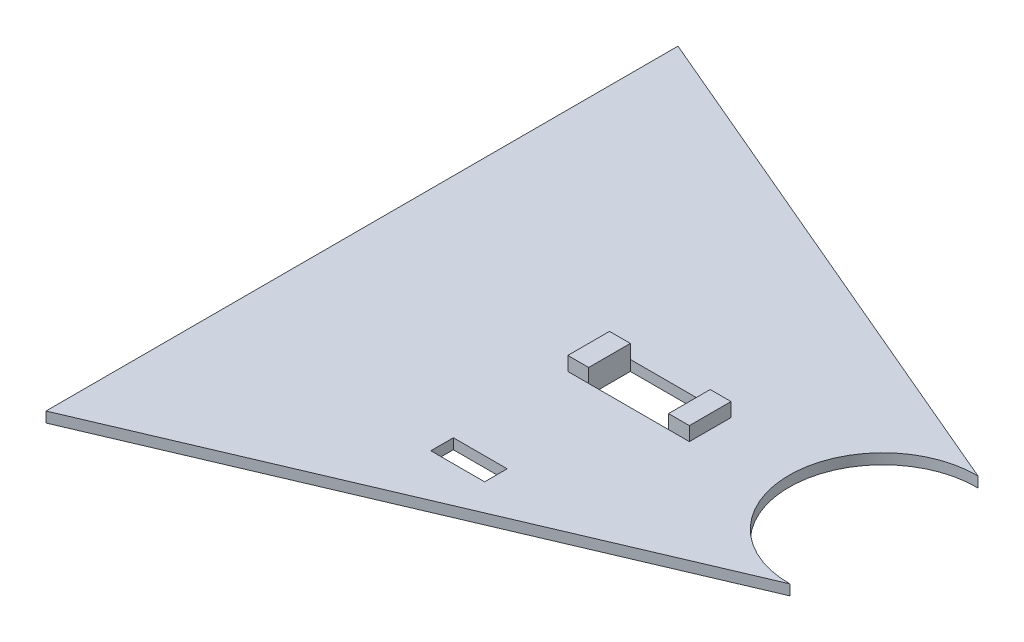
from build123d import *

# Parameters (mm, degrees)
BOSS_EXTRUDE1_DEPTH = 3
SKETCH2_W           = 15.500819923
SKETCH2_H           = 6.5
CUT_EXTRUDE1_DEPTH  = 176.817329233
SKETCH3_W           = 23
SKETCH3_H           = 12
CUT_EXTRUDE2_DEPTH  = 176.817329233
SKETCH4_W           = 6
SKETCH4_H           = 12
BOSS_EXTRUDE2_DEPTH = 4


with BuildPart() as part:
    # Sketch1 → Boss-Extrude1 (new body)
    with BuildSketch(Plane(origin=(0, 0, 0), x_dir=(1, 0, 0), z_dir=(0, 1, 0))):
        with BuildLine():
            Line((0, -91), (0, 91))
            Line((0, 91), (150.405230157, 26.996958875))
            ThreePointArc((150.405230157, 26.996958875), (123.000159405, 0.092778483), (150.219685616, -26.999106249))
            Line((150.219685616, -26.999106249), (0, -91))
        make_face()
    extrude(amount=BOSS_EXTRUDE1_DEPTH)

    # Sketch2 → Cut-Extrude1 (cut, through all)
    with BuildSketch(Plane(origin=(0, 3, 0), x_dir=(1, 0, 0), z_dir=(0, 1, 0))):
        with Locations((73.073381573, -42.257557828)):
            Rectangle(SKETCH2_W, SKETCH2_H)
    extrude(amount=-CUT_EXTRUDE1_DEPTH, mode=Mode.SUBTRACT)

    # Sketch3 → Cut-Extrude2 (cut, through all)
    with BuildSketch(Plane(origin=(0, 3, 0), x_dir=(1, 0, 0), z_dir=(0, 1, 0))):
        with Locations((82.780547291, 0)):
            Rectangle(SKETCH3_W, SKETCH3_H)
    extrude(amount=-CUT_EXTRUDE2_DEPTH, mode=Mode.SUBTRACT)

    # Sketch4 → Boss-Extrude2 (add)
    with BuildSketch(Plane(origin=(0, 3, 0), x_dir=(1, 0, 0), z_dir=(0, 1, 0))):
        with Locations((97.280547291, 0)):
            Rectangle(SKETCH4_W, SKETCH4_H)
        with Locations((68.280547291, 0)):
            Rectangle(SKETCH4_W, SKETCH4_H)
    extrude(amount=BOSS_EXTRUDE2_DEPTH)


solid = part.part
